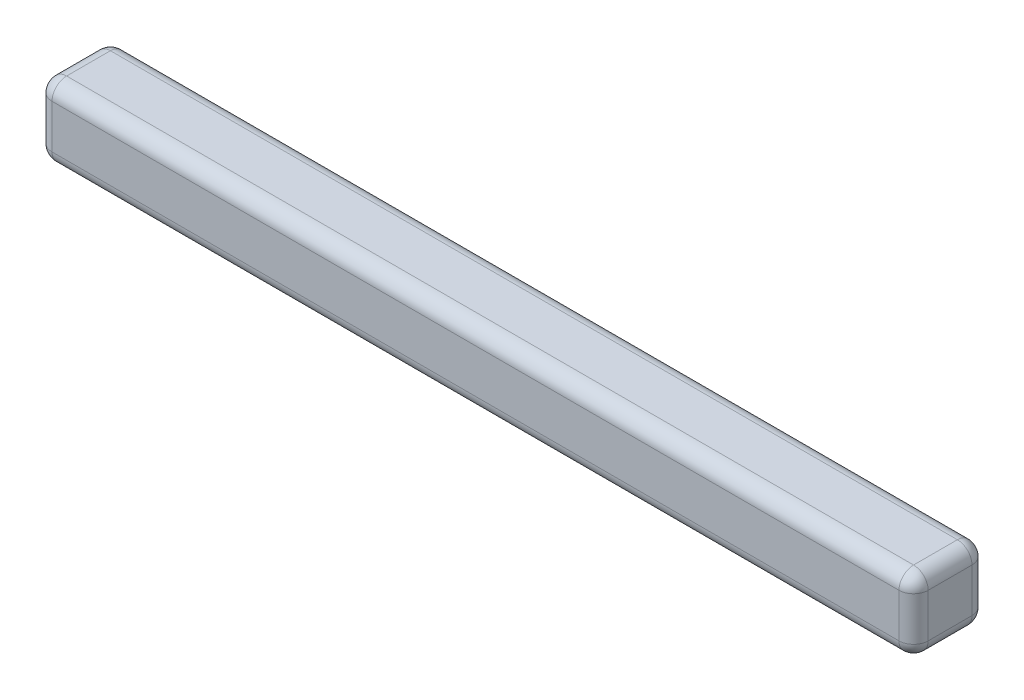
from build123d import *

# Parameters (mm, degrees)
SKETCH1_W           = 60
SKETCH1_H           = 5
BOSS_EXTRUDE1_DEPTH = 5
FILLET1_R           = 1


with BuildPart() as part:
    # Sketch1 → Boss-Extrude1 (new body)
    with BuildSketch(Plane(origin=(0, 0, 0), x_dir=(1, 0, 0), z_dir=(0, 1, 0))):
        Rectangle(SKETCH1_W, SKETCH1_H)
    extrude(amount=BOSS_EXTRUDE1_DEPTH)

    # Fillet1
    fillet1_edges = [part.edges().sort_by_distance(p)[0] for p in [
        (-30, 5, 0),
        (0, 5, 2.5),
        (30, 5, 0),
        (0, 0, 2.5),
        (-30, 0, 0),
        (0, 0, -2.5),
        (30, 0, 0),
        (0, 5, -2.5),
        (30, 2.5, 2.5),
        (-30, 2.5, 2.5),
        (-30, 2.5, -2.5),
        (30, 2.5, -2.5),
    ]]
    fillet(fillet1_edges, radius=FILLET1_R)


solid = part.part
